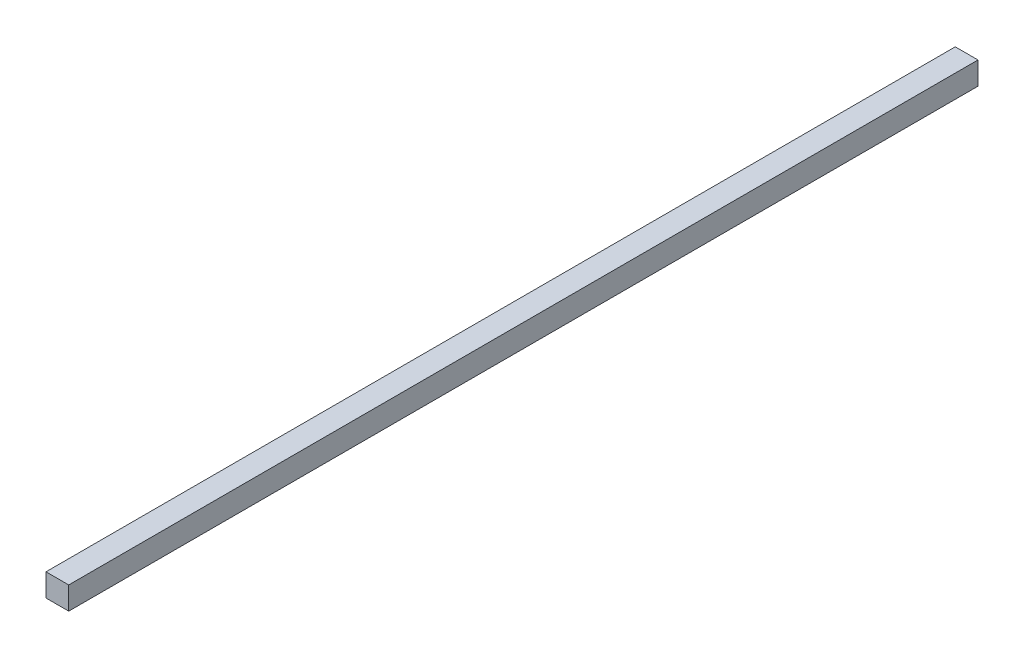
from build123d import *

# Parameters (mm, degrees)
SKETCH2_W           = 25.4
SKETCH2_H           = 25.4
BOSS_EXTRUDE1_DEPTH = 1016


with BuildPart() as part:
    # Sketch2 → Boss-Extrude1 (new body)
    with BuildSketch(Plane.XY):
        with Locations((12.7, 12.7)):
            Rectangle(SKETCH2_W, SKETCH2_H)
    extrude(amount=BOSS_EXTRUDE1_DEPTH)


solid = part.part
